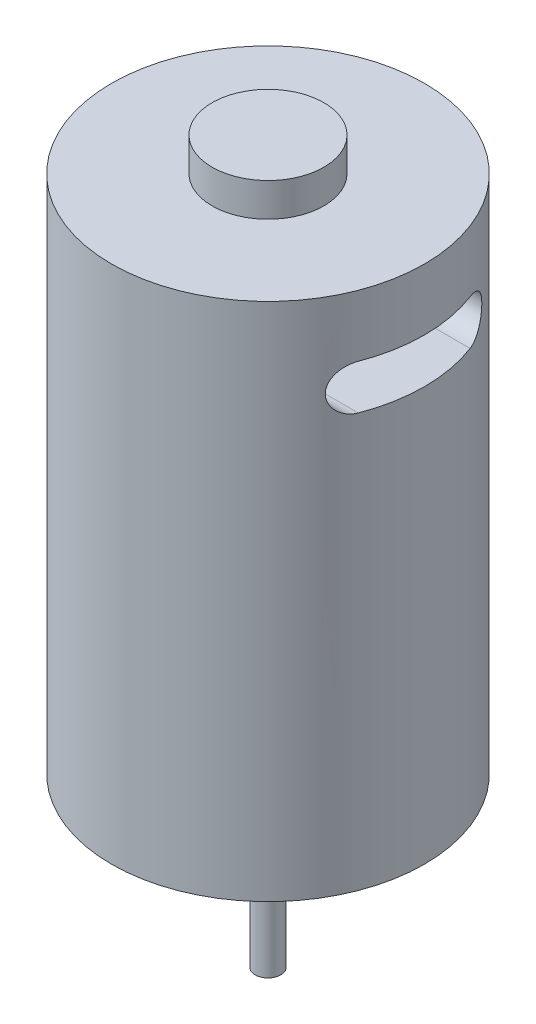
from build123d import *

# Parameters (mm, degrees)
SKETCH2_R               = 1
CUT_EXTRUDE1_DEPTH      = 5
CUT_EXTRUDE2_DEPTH      = 5
CUT_EXTRUDE3_DEPTH      = 68.470363864
CUT_EXTRUDE3_DEPTH_BACK = 68.470363864


with BuildPart() as part:
    # Sketch1 → Revolve1 (revolve)
    with BuildSketch(Plane(origin=(0, 0, 0), x_dir=(0, 0, -1), z_dir=(1, 0, 0)), mode=Mode.PRIVATE) as revolve1_sk:
        Polygon((0, 0), (1.15, 0), (1.15, 12), (5, 12), (5, 15), (14, 15), (14, 61.5), (5, 61.5), (5, 64.5), (0, 64.5), align=None)
    revolve(revolve1_sk.sketch.rotate(Axis((0, 64.5, 0), (0, -1, 0)), 180), axis=Axis((0, 64.5, 0), (0, -1, 0)))

    # Sketch2 → Cut-Extrude1 (cut)
    with BuildSketch(Plane.XZ.offset(-15)):
        with Locations(Location((-8, 0, 0), (0, 0, 270))):
            Circle(SKETCH2_R)
        with Locations(Location((8, 0, 0), (0, 0, 270))):
            Circle(SKETCH2_R)
    extrude(amount=-CUT_EXTRUDE1_DEPTH, mode=Mode.SUBTRACT)

    # Sketch3 → Cut-Extrude2 (cut)
    with BuildSketch(Plane.XZ.offset(-15)):
        with BuildLine():
            ThreePointArc((-5.070033124, 9.19482268), (-7.424621202, 7.424621202), (-9.19482268, 5.070033124))
            ThreePointArc((-9.19482268, 5.070033124), (-8.60556703, 3.03219658), (-6.567730486, 3.621452231))
            ThreePointArc((-6.567730486, 3.621452231), (-5.303300859, 5.303300859), (-3.621452231, 6.567730486))
            ThreePointArc((-3.621452231, 6.567730486), (-3.03219658, 8.60556703), (-5.070033124, 9.19482268))
        make_face()
        with BuildLine():
            ThreePointArc((6.567730486, 3.621452231), (5.303300859, 5.303300859), (3.621452231, 6.567730486))
            ThreePointArc((3.621452231, 6.567730486), (3.03219658, 8.60556703), (5.070033124, 9.19482268))
            ThreePointArc((5.070033124, 9.19482268), (7.424621202, 7.424621202), (9.19482268, 5.070033124))
            ThreePointArc((9.19482268, 5.070033124), (8.60556703, 3.03219658), (6.567730486, 3.621452231))
        make_face()
        with BuildLine():
            ThreePointArc((3.621452231, -6.567730486), (5.303300859, -5.303300859), (6.567730486, -3.621452231))
            ThreePointArc((6.567730486, -3.621452231), (8.60556703, -3.03219658), (9.19482268, -5.070033124))
            ThreePointArc((9.19482268, -5.070033124), (7.424621202, -7.424621202), (5.070033124, -9.19482268))
            ThreePointArc((5.070033124, -9.19482268), (3.03219658, -8.60556703), (3.621452231, -6.567730486))
        make_face()
        with BuildLine():
            ThreePointArc((-6.567730486, -3.621452231), (-5.303300859, -5.303300859), (-3.621452231, -6.567730486))
            ThreePointArc((-3.621452231, -6.567730486), (-3.03219658, -8.60556703), (-5.070033124, -9.19482268))
            ThreePointArc((-5.070033124, -9.19482268), (-7.424621202, -7.424621202), (-9.19482268, -5.070033124))
            ThreePointArc((-9.19482268, -5.070033124), (-8.60556703, -3.03219658), (-6.567730486, -3.621452231))
        make_face()
    extrude(amount=-CUT_EXTRUDE2_DEPTH, mode=Mode.SUBTRACT)

    # Sketch4 → Cut-Extrude3 (cut, two sides: drawn at the far end of the back side and taken through both)
    with BuildSketch(Plane(origin=(0, 0, 0), x_dir=(0, 0, -1), z_dir=(1, 0, 0)).offset(-CUT_EXTRUDE3_DEPTH_BACK)):
        with BuildLine():
            Line((-5, 56), (5, 56))
            ThreePointArc((5, 56), (7, 54), (5, 52))
            Line((5, 52), (-5, 52))
            ThreePointArc((-5, 52), (-7, 54), (-5, 56))
        make_face()
    extrude(amount=CUT_EXTRUDE3_DEPTH + CUT_EXTRUDE3_DEPTH_BACK, mode=Mode.SUBTRACT)


solid = part.part
